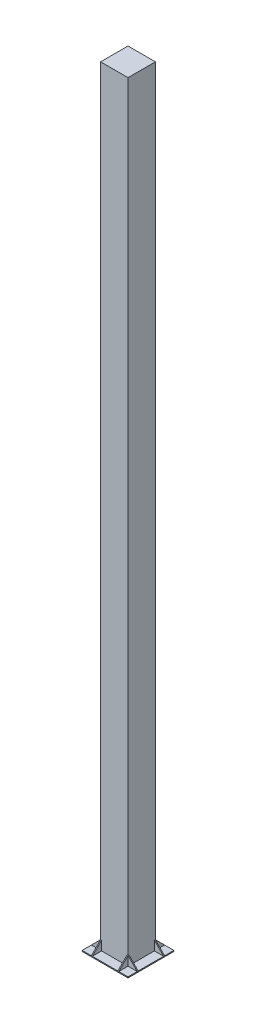
from build123d import *

# Parameters (mm, degrees)
CROQUIS1_W               = 355.6
CROQUIS1_H               = 355.6
SALIENTE_EXTRUIR1_DEPTH  = 10000
CROQUIS2_W               = 595.6
CROQUIS2_H               = 595.6
SALIENTE_EXTRUIR2_DEPTH  = 12.7
SALIENTE_EXTRUIR3_DEPTH  = 12.7
SALIENTE_EXTRUIR4_DEPTH  = 12.7
SALIENTE_EXTRUIR5_DEPTH  = 12.7
SALIENTE_EXTRUIR6_DEPTH  = 12.7
SALIENTE_EXTRUIR7_DEPTH  = 12.7
SALIENTE_EXTRUIR8_DEPTH  = 12.7
SALIENTE_EXTRUIR9_DEPTH  = 12.7
SALIENTE_EXTRUIR10_DEPTH = 12.7


with BuildPart() as part:
    # Croquis1 → Saliente-Extruir1 (new body)
    with BuildSketch(Plane(origin=(0, 0, 0), x_dir=(1, 0, 0), z_dir=(0, 1, 0))):
        Rectangle(CROQUIS1_W, CROQUIS1_H)
    extrude(amount=SALIENTE_EXTRUIR1_DEPTH)

    # Croquis2 → Saliente-Extruir2 (add)
    with BuildSketch(Plane.XZ):
        Rectangle(CROQUIS2_W, CROQUIS2_H)
    extrude(amount=-SALIENTE_EXTRUIR2_DEPTH)

    # Croquis3 → Saliente-Extruir3 (add)
    with BuildSketch(Plane.ZY.offset(177.8)):
        Polygon((-297.8, 12.7), (-177.8, 132.7), (-177.8, 12.7), align=None)
    extrude(amount=-SALIENTE_EXTRUIR3_DEPTH)

    # Croquis4 → Saliente-Extruir4 (add)
    with BuildSketch(Plane(origin=(177.8, 0, 0), x_dir=(0, 0, -1), z_dir=(1, 0, 0))):
        Polygon((177.8, 132.7), (297.8, 12.7), (177.8, 12.7), align=None)
    extrude(amount=-SALIENTE_EXTRUIR4_DEPTH)

    # Croquis5 → Saliente-Extruir5 (add)
    with BuildSketch(Plane.XY.offset(177.8)):
        Polygon((297.8, 12.7), (177.8, 132.7), (177.8, 12.7), align=None)
    extrude(amount=-SALIENTE_EXTRUIR5_DEPTH)

    # Croquis6 → Saliente-Extruir6 (add)
    with BuildSketch(Plane(origin=(0, 0, -177.8), x_dir=(-1, 0, 0), z_dir=(0, 0, -1))):
        Polygon((-177.8, 132.7), (-297.8, 12.7), (-177.8, 12.7), align=None)
    extrude(amount=-SALIENTE_EXTRUIR6_DEPTH)

    # Croquis7 → Saliente-Extruir7 (add)
    with BuildSketch(Plane.ZY.offset(177.8)):
        Polygon((297.8, 12.7), (177.8, 132.7), (177.8, 12.7), align=None)
    extrude(amount=-SALIENTE_EXTRUIR7_DEPTH)

    # Croquis8 → Saliente-Extruir8 (add)
    with BuildSketch(Plane(origin=(177.8, 0, 0), x_dir=(0, 0, -1), z_dir=(1, 0, 0))):
        Polygon((-177.8, 132.7), (-297.8, 12.7), (-177.8, 12.7), align=None)
    extrude(amount=-SALIENTE_EXTRUIR8_DEPTH)

    # Croquis9 → Saliente-Extruir9 (add)
    with BuildSketch(Plane(origin=(0, 0, -177.8), x_dir=(-1, 0, 0), z_dir=(0, 0, -1))):
        Polygon((297.8, 12.7), (177.8, 132.7), (177.8, 12.7), align=None)
    extrude(amount=-SALIENTE_EXTRUIR9_DEPTH)

    # Croquis10 → Saliente-Extruir10 (add)
    with BuildSketch(Plane.XY.offset(177.8)):
        Polygon((-297.8, 12.7), (-177.8, 132.7), (-177.8, 12.7), align=None)
    extrude(amount=-SALIENTE_EXTRUIR10_DEPTH)


solid = part.part
